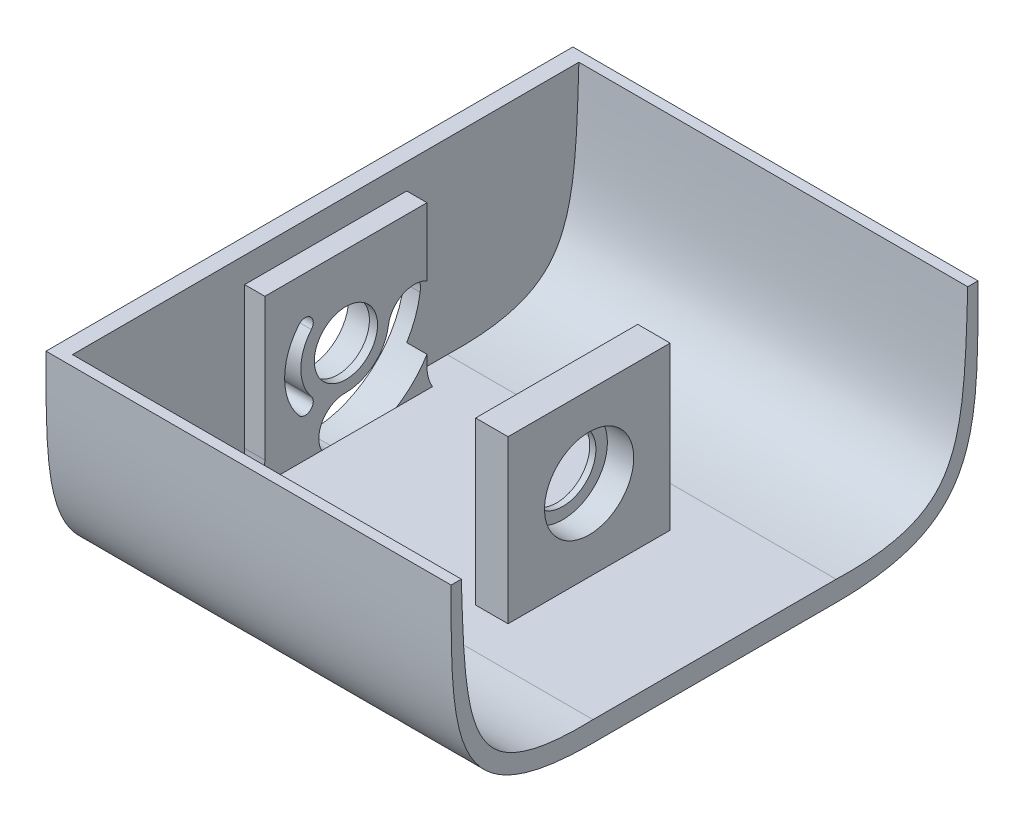
from build123d import *

# Parameters (mm, degrees)
BOSS_EXTRU_2_DEPTH      = 9
ESQUISSE3_R             = 9.644620121
ENL_V_MAT_EXTRU_1_DEPTH = 7
ESQUISSE5_R             = 7.8
ENL_V_MAT_EXTRU_2_DEPTH = 6
ESQUISSE6_W             = 99.948483018
ESQUISSE6_H             = 60
BOSS_EXTRU_3_DEPTH      = 5
ESQUISSE7_W             = 40
ESQUISSE7_H             = 39.978494119
BOSS_EXTRU_4_DEPTH      = 8
ENL_V_START             = -6.48388
ESQUISSE8_R             = 11
ENL_V_MAT_EXTRU_3_DEPTH = 6.48388
ESQUISSE9_R             = 8.165208678
ENL_V_MAT_EXTRU_4_DEPTH = 5
BOSS_EXTRU_5_DEPTH      = 99.948483018
BOSS_EXTRU_6_DEPTH      = 4
ENL_V_START_2           = -9
ENL_V_MAT_EXTRU_5_DEPTH = 9


with BuildPart() as part:
    # Esquisse2 → Boss.-Extru.2 (new body)
    with BuildSketch(Plane.ZY):
        with BuildLine():
            Line((142.883448923, 63.538611727), (142.883448923, 43.560117608))
            Line((142.883448923, 43.560117608), (142.883448923, 28.560117608))
            ThreePointArc((142.883448923, 28.560117608), (142.005344344, 24.462432419), (139.52524414, 21.084386454))
            ThreePointArc((139.52524414, 21.084386454), (136.436102048, 19.212462514), (132.883448923, 18.560117608))
            Line((132.883448923, 18.560117608), (192.883448923, 18.560117608))
            ThreePointArc((192.883448923, 18.560117608), (185.812381111, 21.489049797), (182.883448923, 28.560117608))
            Line((182.883448923, 28.560117608), (182.883448923, 43.560117608))
            Line((182.883448923, 43.560117608), (182.883448923, 63.538611727))
            Line((182.883448923, 63.538611727), (163.81068824, 63.538611727))
            Line((163.81068824, 63.538611727), (161.956209605, 63.538611727))
            Line((161.956209605, 63.538611727), (142.883448923, 63.538611727))
        make_face()
    extrude(amount=-BOSS_EXTRU_2_DEPTH)

    # Esquisse3 → Enlèv. mat.-Extru.1 (cut)
    with BuildSketch(Plane.ZY):
        with Locations((162.883448923, 43.560117608)):
            Circle(ESQUISSE3_R)
    extrude(amount=-ENL_V_MAT_EXTRU_1_DEPTH, mode=Mode.SUBTRACT)

    # Esquisse5 → Enlèv. mat.-Extru.2 (cut)
    with BuildSketch(Plane(origin=(9, 0, 0), x_dir=(0, 0, -1), z_dir=(1, 0, 0))):
        with Locations((-162.883448923, 43.560117608)):
            Circle(ESQUISSE5_R)
    extrude(amount=-ENL_V_MAT_EXTRU_2_DEPTH, mode=Mode.SUBTRACT)

    # Esquisse6 → Boss.-Extru.3 (add)
    with BuildSketch(Plane.XZ.offset(-18.560117608)):
        with Locations((49.974241509, 162.883448923)):
            Rectangle(ESQUISSE6_W, ESQUISSE6_H)
    extrude(amount=-BOSS_EXTRU_3_DEPTH)

    # Esquisse7 → Boss.-Extru.4 (add)
    with BuildSketch(Plane(origin=(69, 0, 0), x_dir=(0, 0, -1), z_dir=(1, 0, 0))):
        with Locations((-162.883448923, 43.549364668)):
            Rectangle(ESQUISSE7_W, ESQUISSE7_H)
    extrude(amount=-BOSS_EXTRU_4_DEPTH)

    # Esquisse8 → Enlèv. mat.-Extru.3 (cut)
    with BuildSketch(Plane(origin=(69, 0, 0), x_dir=(0, 0, -1), z_dir=(1, 0, 0)).offset(ENL_V_START)):
        with Locations((-162.883448923, 43.560117608)):
            Circle(ESQUISSE8_R)
    extrude(amount=ENL_V_MAT_EXTRU_3_DEPTH, mode=Mode.SUBTRACT)

    # Esquisse9 → Enlèv. mat.-Extru.4 (cut)
    with BuildSketch(Plane.ZY.offset(-61)):
        with Locations((162.883448923, 43.560117608)):
            Circle(ESQUISSE9_R)
    extrude(amount=-ENL_V_MAT_EXTRU_4_DEPTH, mode=Mode.SUBTRACT)

    # Esquisse10 → Boss.-Extru.5 (add)
    with BuildSketch(Plane(origin=(99.948483018, 0, 0), x_dir=(0, 0, -1), z_dir=(1, 0, 0))):
        with BuildLine():
            Line((-97.883448923, 69.817685904), (-100.410150097, 69.817685904))
            add(Edge.make_bspline(
                [(-100.410150097, 69.817685904), (-100.442033213, 68.80607378), (-100.50563029, 66.760024387), (-100.63239049, 62.850470513), (-100.810316501, 58.185123949), (-101.105084062, 52.996004141), (-101.670642078, 46.633188552), (-102.817961278, 39.776477829), (-104.76530294, 34.527578685), (-106.865826561, 31.248687809), (-108.756421045, 29.177953286), (-111.059219045, 27.42366281), (-113.90944146, 25.950331771), (-117.143373053, 24.872521409), (-119.940370542, 24.290171621), (-122.233093244, 23.949469798), (-124.260913893, 23.72661052), (-126.900847008, 23.559278589), (-129.29031887, 23.506975385), (-131.301500979, 23.518901656), (-132.360719769, 23.543642683), (-132.883448923, 23.560117608)],
                knots=[0, 0, 0, 0, 0.03125, 0.0625, 0.125, 0.1875, 0.25, 0.375, 0.5, 0.5625, 0.625, 0.6875, 0.75, 0.8125, 0.859709617, 0.875334617, 0.90625, 0.9375, 0.96875, 0.984375, 1, 1, 1, 1], degree=3))
            Line((-132.883448923, 23.560117608), (-192.883448923, 23.560117608))
            add(Edge.make_bspline(
                [(-192.883448923, 23.560117608), (-193.406178076, 23.543642683), (-194.465396866, 23.518901656), (-196.476578975, 23.506975385), (-198.866050837, 23.559278589), (-201.50594164, 23.726607838), (-203.533727382, 23.949460813), (-205.826459718, 24.290158055), (-208.623496676, 24.872512038), (-211.857456385, 25.950331771), (-214.7076788, 27.42366281), (-217.0104768, 29.177953286), (-218.901071284, 31.248687809), (-221.001594905, 34.527578685), (-222.948936567, 39.776477829), (-224.096255768, 46.633188552), (-224.661813783, 52.996004141), (-224.956581344, 58.185123949), (-225.134507355, 62.850470513), (-225.261267555, 66.760024387), (-225.324864632, 68.80607378), (-225.356747748, 69.817685904)],
                knots=[0, 0, 0, 0, 0.015625, 0.03125, 0.0625, 0.09375, 0.124663886, 0.140288886, 0.1875, 0.25, 0.3125, 0.375, 0.4375, 0.5, 0.625, 0.75, 0.8125, 0.875, 0.9375, 0.96875, 1, 1, 1, 1], degree=3))
            Line((-225.356747748, 69.817685904), (-227.883448923, 69.817685904))
            add(Edge.make_bspline(
                [(-227.883448923, 69.817685904), (-227.883448923, 36.967980152), (-228.338510952, 18.560117608), (-192.883448923, 18.560117608)],
                knots=[0, 0, 0, 0, 1, 1, 1, 1], degree=3))
            Line((-192.883448923, 18.560117608), (-132.883448923, 18.560117608))
            add(Edge.make_bspline(
                [(-97.883448923, 69.817685904), (-97.883448923, 36.967980152), (-97.428386893, 18.560117608), (-132.883448923, 18.560117608)],
                knots=[0, 0, 0, 0, 1, 1, 1, 1], degree=3))
        make_face()
    extrude(amount=-BOSS_EXTRU_5_DEPTH)

    # Esquisse11 → Boss.-Extru.6 (add)
    with BuildSketch(Plane.ZY):
        with BuildLine():
            Line((225.356747748, 69.817685904), (100.410150097, 69.817685904))
            add(Edge.make_bspline(
                [(100.410150097, 69.817685904), (100.442033213, 68.80607378), (100.50563029, 66.760024387), (100.63239049, 62.850470513), (100.810316501, 58.185123949), (101.105084062, 52.996004141), (101.670642078, 46.633188552), (102.817961278, 39.776477829), (104.76530294, 34.527578685), (106.865826561, 31.248687809), (108.756421045, 29.177953286), (111.059219045, 27.42366281), (113.90944146, 25.950331771), (117.143373053, 24.872521409), (119.940370542, 24.290171621), (122.233093244, 23.949469798), (124.260913893, 23.72661052), (126.900847008, 23.559278589), (129.29031887, 23.506975385), (131.301500979, 23.518901656), (132.360719769, 23.543642683), (132.883448923, 23.560117608)],
                knots=[0, 0, 0, 0, 0.03125, 0.0625, 0.125, 0.1875, 0.25, 0.375, 0.5, 0.5625, 0.625, 0.6875, 0.75, 0.8125, 0.859709617, 0.875334617, 0.90625, 0.9375, 0.96875, 0.984375, 1, 1, 1, 1], degree=3))
            Line((132.883448923, 23.560117608), (141.54370296, 23.560117608))
            ThreePointArc((141.54370296, 23.560117608), (142.542707185, 25.971927157), (142.883448923, 28.560117608))
            Line((142.883448923, 28.560117608), (142.883448923, 63.538611727))
            Line((142.883448923, 63.538611727), (182.883448923, 63.538611727))
            Line((182.883448923, 63.538611727), (182.883448923, 28.560117608))
            ThreePointArc((182.883448923, 28.560117608), (183.22419066, 25.971927157), (184.223194885, 23.560117608))
            Line((184.223194885, 23.560117608), (192.883448923, 23.560117608))
            add(Edge.make_bspline(
                [(192.883448923, 23.560117608), (193.406178076, 23.543642683), (194.465396866, 23.518901656), (196.476578975, 23.506975385), (198.866050837, 23.559278589), (201.50594164, 23.726607838), (203.533727382, 23.949460813), (205.826459718, 24.290158055), (208.623496676, 24.872512038), (211.857456385, 25.950331771), (214.7076788, 27.42366281), (217.0104768, 29.177953286), (218.901071284, 31.248687809), (221.001594905, 34.527578685), (222.948936567, 39.776477829), (224.096255768, 46.633188552), (224.661813783, 52.996004141), (224.956581344, 58.185123949), (225.134507355, 62.850470513), (225.261267555, 66.760024387), (225.324864632, 68.80607378), (225.356747748, 69.817685904)],
                knots=[0, 0, 0, 0, 0.015625, 0.03125, 0.0625, 0.09375, 0.124663886, 0.140288886, 0.1875, 0.25, 0.3125, 0.375, 0.4375, 0.5, 0.625, 0.75, 0.8125, 0.875, 0.9375, 0.96875, 1, 1, 1, 1], degree=3))
        make_face()
    extrude(amount=-BOSS_EXTRU_6_DEPTH)

    # Esquisse12 → Enlèv. mat.-Extru.5 (cut)
    with BuildSketch(Plane.ZY.offset(ENL_V_START_2)):
        with BuildLine():
            ThreePointArc((163.014719877, 32.973509037), (155.990303326, 35.524070266), (152.400224234, 42.078391173))
            ThreePointArc((152.400224234, 42.078391173), (145.080424512, 47.585238943), (139.573576742, 40.265439221))
            ThreePointArc((139.573576742, 40.265439221), (147.556262152, 25.691642787), (163.175335174, 20.020367203))
            ThreePointArc((163.175335174, 20.020367203), (169.571598443, 26.577245769), (163.014719877, 32.973509037))
        make_face()
        with BuildLine():
            ThreePointArc((171.408584799, 50.713555978), (174.012223438, 43.560117608), (171.408584799, 36.406679239))
            ThreePointArc((171.408584799, 36.406679239), (171.655098465, 33.589015134), (174.472762571, 33.8355288))
            ThreePointArc((174.472762571, 33.8355288), (178.012223438, 43.560117608), (174.472762571, 53.284706416))
            ThreePointArc((174.472762571, 53.284706416), (171.655098465, 53.531220083), (171.408584799, 50.713555978))
        make_face()
    extrude(amount=ENL_V_MAT_EXTRU_5_DEPTH, mode=Mode.SUBTRACT)


solid = part.part
